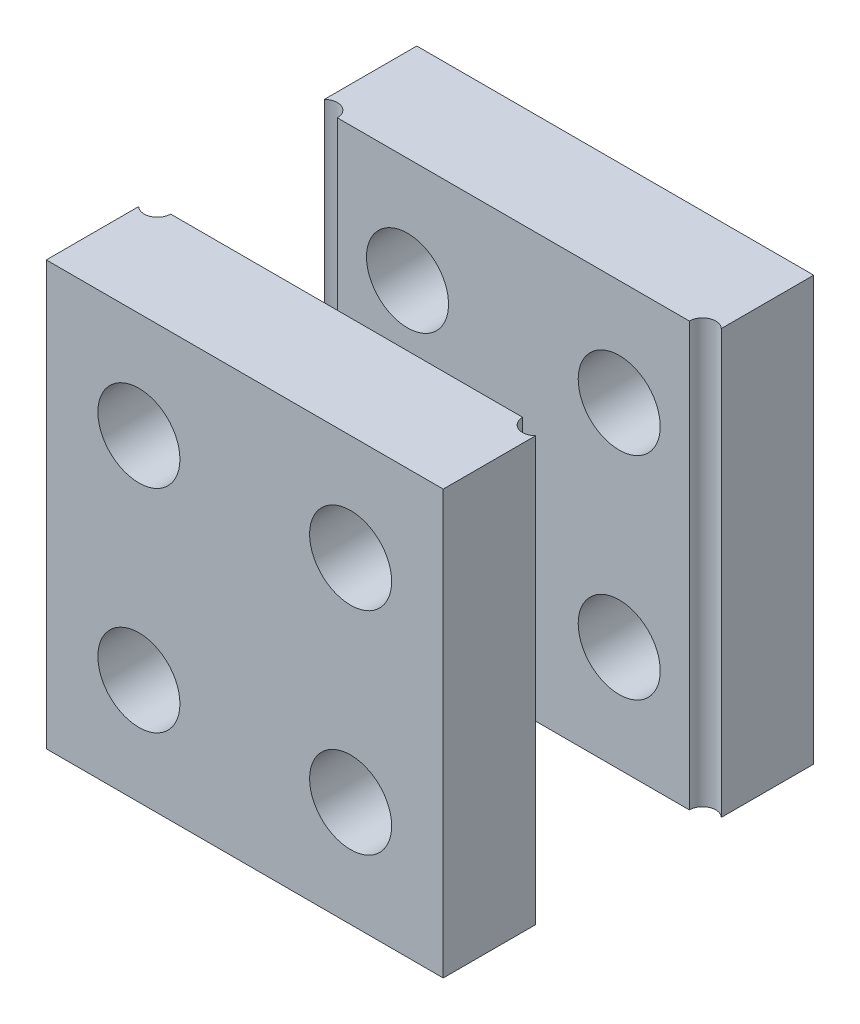
from build123d import *

# Parameters (mm, degrees)
SKETCH_1_W               = 15
SKETCH_1_H               = 16
SKETCH_1_R               = 1.55
EXTRUDE_1_DEPTH          = 14
CUT_EXTRUDE_1_DEPTH      = 23.544400635
CUT_EXTRUDE_1_DEPTH_BACK = 23.544400635
SKETCH_2_R               = 0.5
SKETCH_2_W               = 15.3
SKETCH_2_H               = 6.3


with BuildPart() as part:
    # 草图1 → 凸台-拉伸1 (new body)
    with BuildSketch(Plane.XY):
        Rectangle(SKETCH_1_W, SKETCH_1_H)
        with Locations((-4, 4)):
            Circle(SKETCH_1_R, mode=Mode.SUBTRACT)
        with Locations((4, 4)):
            Circle(SKETCH_1_R, mode=Mode.SUBTRACT)
        with Locations((-4, -4)):
            Circle(SKETCH_1_R, mode=Mode.SUBTRACT)
        with Locations((4, -4)):
            Circle(SKETCH_1_R, mode=Mode.SUBTRACT)
    extrude(amount=EXTRUDE_1_DEPTH)

    # 草图2 → 切除-拉伸1 (cut, two sides: drawn at the far end of the back side and taken through both)
    with BuildSketch(Plane(origin=(0, 8, 0), x_dir=(1, 0, 0), z_dir=(0, 1, 0)).offset(-CUT_EXTRUDE_1_DEPTH_BACK)):
        with Locations((-7.15, -10.15)):
            Circle(SKETCH_2_R)
        with Locations((7.15, -10.15)):
            Circle(SKETCH_2_R)
        with Locations((7.15, -3.85)):
            Circle(SKETCH_2_R)
        with Locations((-7.15, -3.85)):
            Circle(SKETCH_2_R)
        with Locations((0, -7)):
            Rectangle(SKETCH_2_W, SKETCH_2_H)
        with BuildLine():
            ThreePointArc((-6.65, -3.85), (-7.15, -3.35), (-7.65, -3.85))
            Line((-7.65, -3.85), (-6.65, -3.85))
        make_face()
        with BuildLine():
            Line((-6.65, -3.85), (-7.65, -3.85))
            ThreePointArc((-7.65, -3.85), (-7.15, -4.35), (-6.65, -3.85))
        make_face()
        with BuildLine():
            ThreePointArc((-7.65, -10.15), (-7.15, -10.65), (-6.65, -10.15))
            Line((-6.65, -10.15), (-7.65, -10.15))
        make_face()
        with BuildLine():
            Line((-7.65, -10.15), (-6.65, -10.15))
            ThreePointArc((-6.65, -10.15), (-7.15, -9.65), (-7.65, -10.15))
        make_face()
        with BuildLine():
            ThreePointArc((6.65, -3.85), (7.15, -4.35), (7.65, -3.85))
            Line((7.65, -3.85), (6.65, -3.85))
        make_face()
        with BuildLine():
            Line((6.65, -3.85), (7.65, -3.85))
            ThreePointArc((7.65, -3.85), (7.15, -3.35), (6.65, -3.85))
        make_face()
        with BuildLine():
            ThreePointArc((7.65, -10.15), (7.15, -9.65), (6.65, -10.15))
            Line((6.65, -10.15), (7.65, -10.15))
        make_face()
        with BuildLine():
            Line((7.65, -10.15), (6.65, -10.15))
            ThreePointArc((6.65, -10.15), (7.15, -10.65), (7.65, -10.15))
        make_face()
    extrude(amount=CUT_EXTRUDE_1_DEPTH + CUT_EXTRUDE_1_DEPTH_BACK, mode=Mode.SUBTRACT)


with BuildPart() as cut_extrude_1_piece_1:
    # of the separate pieces the step leaves, piece 1, a body of its own (cut_extrude_1_pieces)
    add(part.part.solids().sort_by_distance((7.5, -8, 0))[0])


with BuildPart() as cut_extrude_1_piece_2:
    # of the separate pieces the step leaves, piece 2, a body of its own (cut_extrude_1_pieces)
    add(part.part.solids().sort_by_distance((7.5, -8, 10.507071421))[0])


solid = Compound([cut_extrude_1_piece_1.part, cut_extrude_1_piece_2.part])
